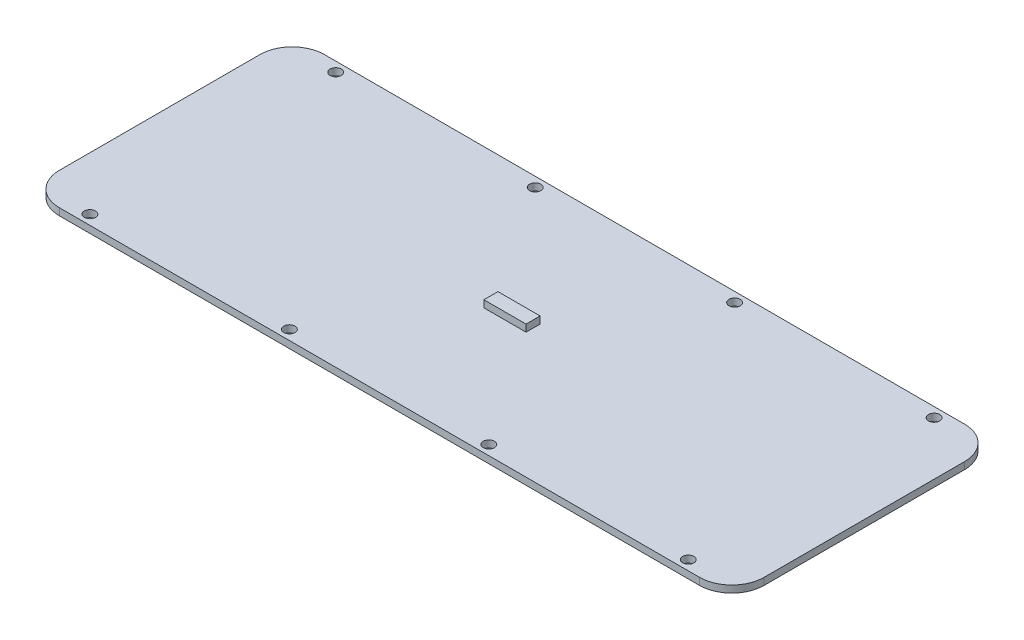
from build123d import *

# Parameters (mm, degrees)
SKETCH2_R           = 4
SKETCH2_W           = 30
SKETCH2_H           = 10
BOSS_EXTRUDE1_DEPTH = 5
SKETCH2_2_W         = 30
SKETCH2_2_H         = 10
BOSS_EXTRUDE2_DEPTH = 10


with BuildPart() as part:
    # Sketch2 → Boss-Extrude1 (new body)
    with BuildSketch(Plane(origin=(0, 0, 0), x_dir=(1, 0, 0), z_dir=(0, 1, 0))):
        with BuildLine():
            Line((-227.9, -94.4), (227.9, -94.4))
            ThreePointArc((227.9, -94.4), (244.163455967, -87.663455967), (250.9, -71.4))
            Line((250.9, -71.4), (250.9, 71.4))
            ThreePointArc((250.9, 71.4), (244.163455967, 87.663455967), (227.9, 94.4))
            Line((227.9, 94.4), (-227.9, 94.4))
            ThreePointArc((-227.9, 94.4), (-244.163455967, 87.663455967), (-250.9, 71.4))
            Line((-250.9, 71.4), (-250.9, -71.4))
            ThreePointArc((-250.9, -71.4), (-244.163455967, -87.663455967), (-227.9, -94.4))
        make_face()
        with Locations((-213, 87.5)):
            Circle(SKETCH2_R, mode=Mode.SUBTRACT)
        with Locations((-71, 87.5)):
            Circle(SKETCH2_R, mode=Mode.SUBTRACT)
        with Locations((71, 87.5)):
            Circle(SKETCH2_R, mode=Mode.SUBTRACT)
        with Locations((213, 87.5)):
            Circle(SKETCH2_R, mode=Mode.SUBTRACT)
        with Locations((213, -87.5)):
            Circle(SKETCH2_R, mode=Mode.SUBTRACT)
        with Locations((71, -87.5)):
            Circle(SKETCH2_R, mode=Mode.SUBTRACT)
        with Locations((-71, -87.5)):
            Circle(SKETCH2_R, mode=Mode.SUBTRACT)
        with Locations((-213, -87.5)):
            Circle(SKETCH2_R, mode=Mode.SUBTRACT)
        Rectangle(SKETCH2_W, SKETCH2_H, mode=Mode.SUBTRACT)
    extrude(amount=BOSS_EXTRUDE1_DEPTH)

    # Sketch2<2> → Boss-Extrude2 (add)
    with BuildSketch(Plane(origin=(0, 0, 0), x_dir=(1, 0, 0), z_dir=(0, 1, 0))):
        Rectangle(SKETCH2_2_W, SKETCH2_2_H)
    extrude(amount=BOSS_EXTRUDE2_DEPTH)


solid = part.part
